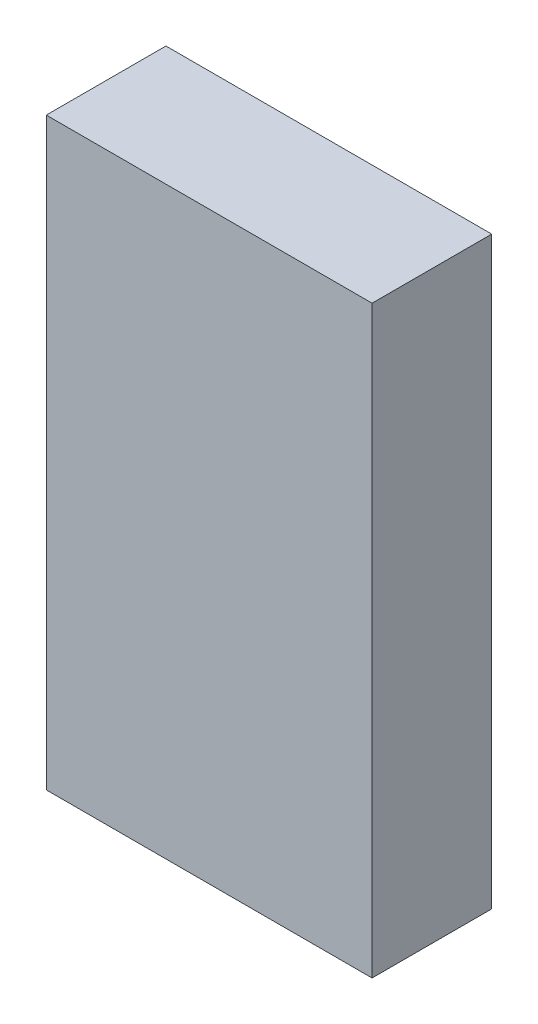
from build123d import *

# Parameters (mm, degrees)
SKETCH_1_W      = 27.228527008
SKETCH_1_H      = 48.84415817
EXTRUDE_1_DEPTH = 10


with BuildPart() as part:
    # Эскиз1 → Бобышка-Вытянуть1 (new body)
    with BuildSketch(Plane.XY):
        Rectangle(SKETCH_1_W, SKETCH_1_H)
    extrude(amount=EXTRUDE_1_DEPTH)


solid = part.part
